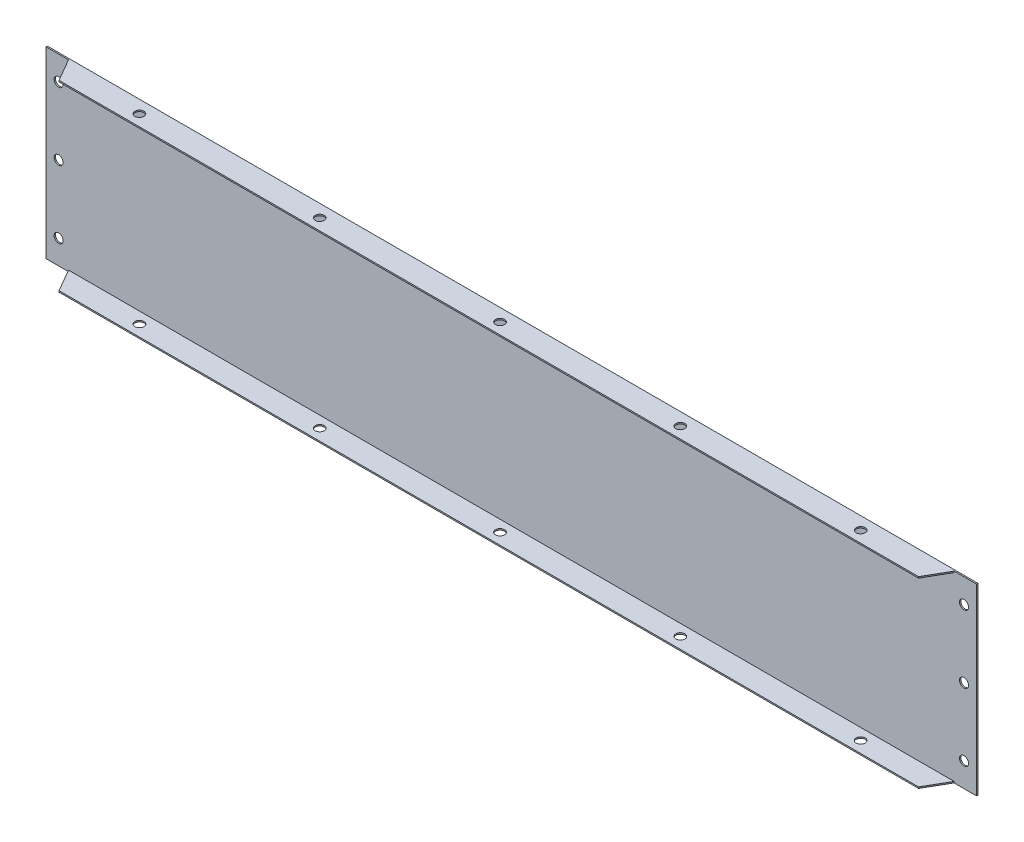
from build123d import *

# Parameters (mm, degrees)
SKETCH_1_W      = 412.9
SKETCH_1_H      = 81.4
SKETCH_1_R      = 2
EXTRUDE_1_DEPTH = 0.6
SKETCH_2_R      = 2
EXTRUDE_2_DEPTH = 0.6
EXTRUDE_START   = -0.6
SKETCH_3_R      = 2
EXTRUDE_3_DEPTH = 0.6


with BuildPart() as part:
    # Эскиз1 → Бобышка-Вытянуть1 (new body)
    with BuildSketch(Plane.XY):
        with Locations((241.1, 40.7)):
            Rectangle(SKETCH_1_W, SKETCH_1_H)
        with Locations((40.25, 10.7)):
            Circle(SKETCH_1_R, mode=Mode.SUBTRACT)
        with Locations((441.95, 10.7)):
            Circle(SKETCH_1_R, mode=Mode.SUBTRACT)
        with Locations((40.25, 40.7)):
            Circle(SKETCH_1_R, mode=Mode.SUBTRACT)
        with Locations((40.25, 70.7)):
            Circle(SKETCH_1_R, mode=Mode.SUBTRACT)
        with Locations((441.95, 40.7)):
            Circle(SKETCH_1_R, mode=Mode.SUBTRACT)
        with Locations((441.95, 70.7)):
            Circle(SKETCH_1_R, mode=Mode.SUBTRACT)
    extrude(amount=EXTRUDE_1_DEPTH)

    # Эскиз2 → Бобышка-Вытянуть2 (add)
    with BuildSketch(Plane(origin=(0, 81.4, 0), x_dir=(1, 0, 0), z_dir=(0, 1, 0))):
        Polygon((44.65, -0.6), (50.423502692, -10.6), (431.776497308, -10.6), (437.55, -0.6), align=None)
        with Locations(Location((401.1, -5.6, 0), (0, 0, 180))):
            Circle(SKETCH_2_R, mode=Mode.SUBTRACT)
        with Locations(Location((321.1, -5.6, 0), (0, 0, 180))):
            Circle(SKETCH_2_R, mode=Mode.SUBTRACT)
        with Locations(Location((241.1, -5.6, 0), (0, 0, 180))):
            Circle(SKETCH_2_R, mode=Mode.SUBTRACT)
        with Locations(Location((161.1, -5.6, 0), (0, 0, 180))):
            Circle(SKETCH_2_R, mode=Mode.SUBTRACT)
        with Locations(Location((81.1, -5.6, 0), (0, 0, 180))):
            Circle(SKETCH_2_R, mode=Mode.SUBTRACT)
    extrude(amount=-EXTRUDE_2_DEPTH)

    # Эскиз3 → Бобышка-Вытянуть3 (add)
    with BuildSketch(Plane.XZ.offset(EXTRUDE_START)):
        Polygon((44.65, 0.6), (437.55, 0.6), (431.776497308, 10.6), (50.423502692, 10.6), align=None)
        with Locations(Location((401.1, 5.6, 0), (0, 0, 180))):
            Circle(SKETCH_3_R, mode=Mode.SUBTRACT)
        with Locations(Location((321.1, 5.6, 0), (0, 0, 180))):
            Circle(SKETCH_3_R, mode=Mode.SUBTRACT)
        with Locations(Location((241.1, 5.6, 0), (0, 0, 180))):
            Circle(SKETCH_3_R, mode=Mode.SUBTRACT)
        with Locations(Location((161.1, 5.6, 0), (0, 0, 180))):
            Circle(SKETCH_3_R, mode=Mode.SUBTRACT)
        with Locations(Location((81.1, 5.6, 0), (0, 0, 180))):
            Circle(SKETCH_3_R, mode=Mode.SUBTRACT)
    extrude(amount=EXTRUDE_3_DEPTH)


solid = part.part
